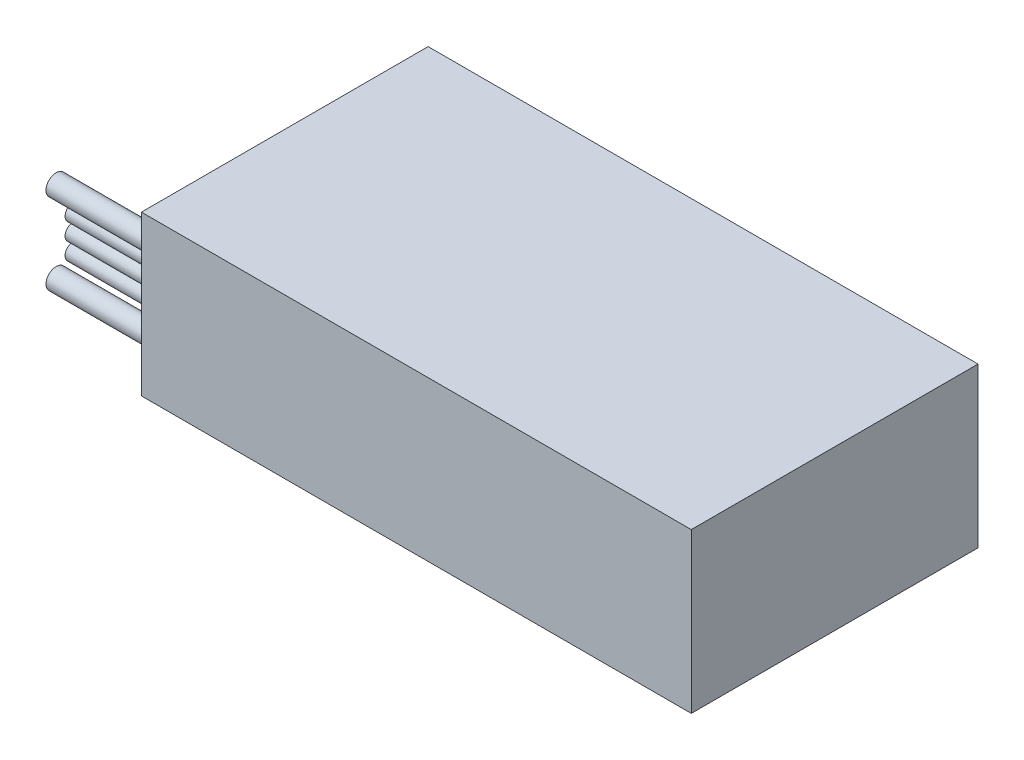
from build123d import *

# Parameters (mm, degrees)
SKETCH1_W           = 67.7
SKETCH1_H           = 19.6
BOSS_EXTRUDE1_DEPTH = 35.3
SKETCH3_R           = 1
SKETCH3_R_2         = 1.25
BOSS_EXTRUDE2_DEPTH = 13


with BuildPart() as part:
    # Sketch1 → Boss-Extrude1 (new body)
    with BuildSketch(Plane.XY):
        with Locations((33.85, 9.8)):
            Rectangle(SKETCH1_W, SKETCH1_H)
    extrude(amount=BOSS_EXTRUDE1_DEPTH)

    # Sketch3 → Boss-Extrude2 (add)
    with BuildSketch(Plane.ZY):
        with Locations(Location((30.7, 12.95, 0), (0, 0, 180))):
            Circle(SKETCH3_R)
        with Locations(Location((30.7, 10.85, 0), (0, 0, 180))):
            Circle(SKETCH3_R)
        with Locations(Location((30.7, 8.75, 0), (0, 0, 180))):
            Circle(SKETCH3_R)
        with Locations(Location((32.8, 4.8, 0), (0, 0, 180))):
            Circle(SKETCH3_R_2)
        with Locations(Location((32.8, 14.8, 0), (0, 0, 180))):
            Circle(SKETCH3_R_2)
        with Locations(Location((30.7, 6.65, 0), (0, 0, 180))):
            Circle(SKETCH3_R)
    extrude(amount=BOSS_EXTRUDE2_DEPTH)


solid = part.part
